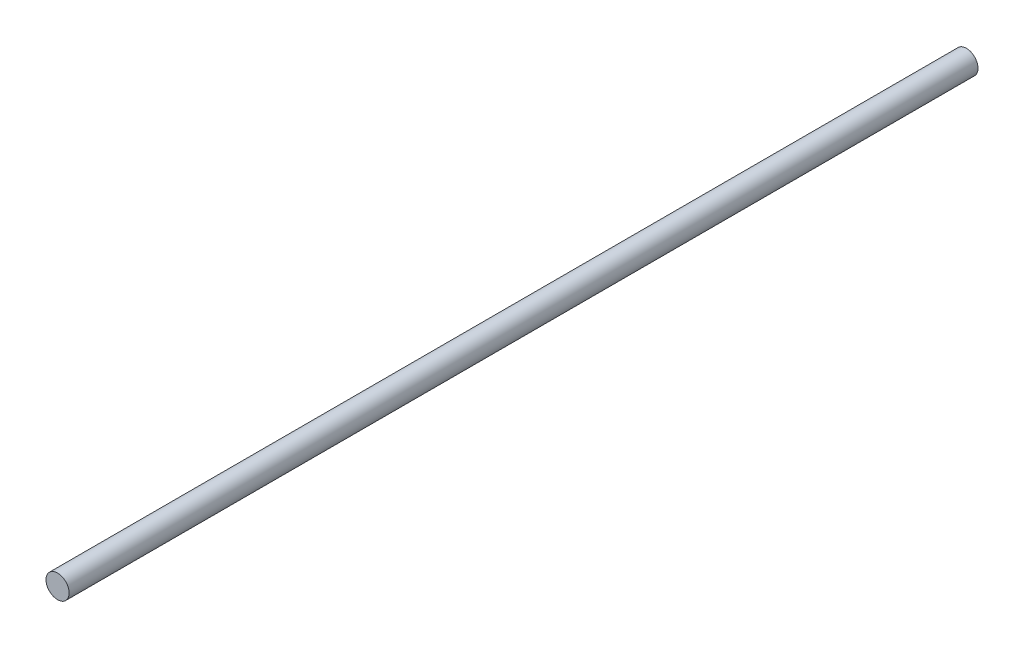
from build123d import *

# Parameters (mm, degrees)
SKETCH1_R           = 4
BOSS_EXTRUDE1_DEPTH = 314


with BuildPart() as part:
    # Sketch1 → Boss-Extrude1 (new body)
    with BuildSketch(Plane.XY):
        Circle(SKETCH1_R)
    extrude(amount=BOSS_EXTRUDE1_DEPTH)


solid = part.part
